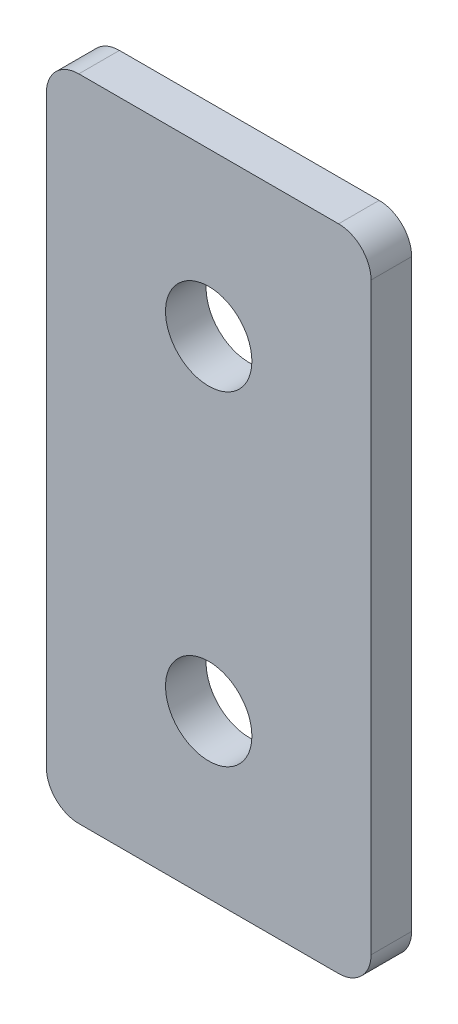
from build123d import *

# Parameters (mm, degrees)
SKETCH1_R           = 3.3782
BOSS_EXTRUDE1_DEPTH = 3.175


with BuildPart() as part:
    # Sketch1 → Boss-Extrude1 (new body)
    with BuildSketch(Plane.XY):
        with BuildLine():
            Line((-10.16, -25.4), (10.16, -25.4))
            ThreePointArc((10.16, -25.4), (11.956051224, -24.656051224), (12.7, -22.86))
            Line((12.7, -22.86), (12.7, 22.86))
            ThreePointArc((12.7, 22.86), (11.956051224, 24.656051224), (10.16, 25.4))
            Line((10.16, 25.4), (-10.16, 25.4))
            ThreePointArc((-10.16, 25.4), (-11.956051224, 24.656051224), (-12.7, 22.86))
            Line((-12.7, 22.86), (-12.7, -22.86))
            ThreePointArc((-12.7, -22.86), (-11.956051224, -24.656051224), (-10.16, -25.4))
        make_face()
        with Locations((0, 12.7)):
            Circle(SKETCH1_R, mode=Mode.SUBTRACT)
        with Locations((0, -12.7)):
            Circle(SKETCH1_R, mode=Mode.SUBTRACT)
    extrude(amount=BOSS_EXTRUDE1_DEPTH)


solid = part.part
